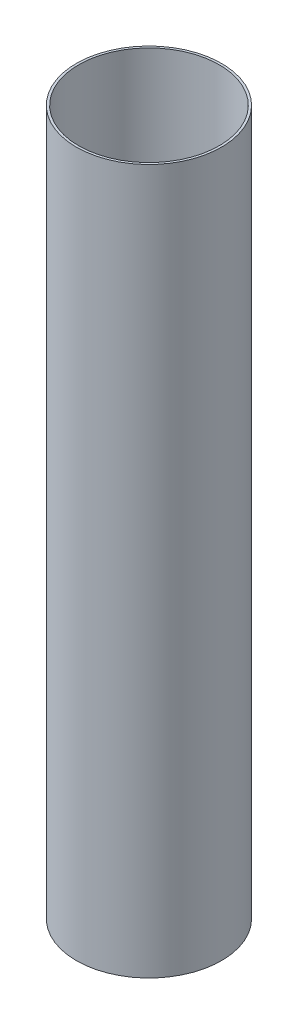
from build123d import *

# Parameters (mm, degrees)
SKETCH1_R           = 78.5
SKETCH1_R_2         = 76
BOSS_EXTRUDE1_DEPTH = 762


with BuildPart() as part:
    # Sketch1 → Boss-Extrude1 (new body)
    with BuildSketch(Plane(origin=(0, 0, 0), x_dir=(1, 0, 0), z_dir=(0, 1, 0))):
        with Locations(Location((0, 0, 0), (0, 0, 270))):
            Circle(SKETCH1_R)
        with Locations(Location((0, 0, 0), (0, 0, 270))):
            Circle(SKETCH1_R_2, mode=Mode.SUBTRACT)
    extrude(amount=BOSS_EXTRUDE1_DEPTH)


solid = part.part
